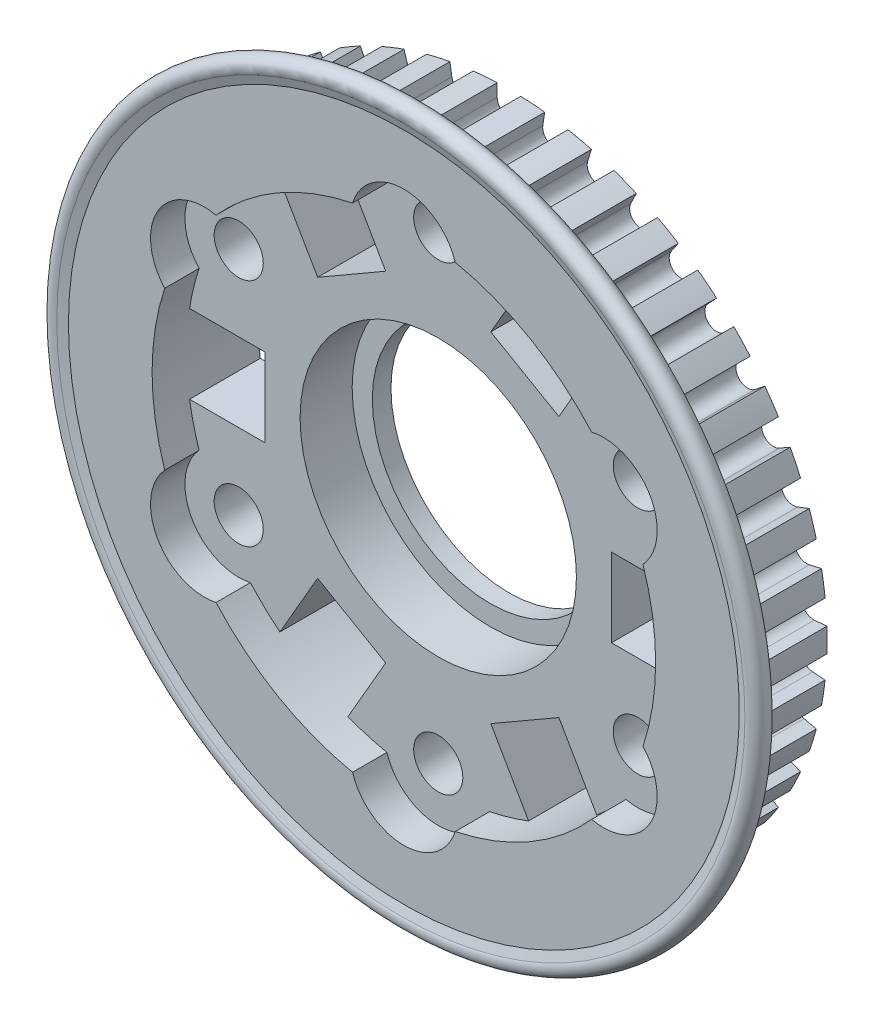
from build123d import *

# Parameters (mm, degrees)
CUT_EXTRUDE1_DEPTH  = 3.556
SKETCH6_R           = 2.54
CUT_EXTRUDE2_DEPTH  = 53.934626978
SKETCH7_R           = 4.1529
CUT_EXTRUDE3_DEPTH  = 1.397
SKETCH8_R           = 4.1275
SKETCH8_R_2         = 2.54
BOSS_EXTRUDE2_DEPTH = 1.27
CUT_EXTRUDE4_DEPTH  = 8.1788


with BuildPart() as part:
    # Sketch3 → Revolve1 (revolve)
    with BuildSketch(Plane(origin=(0, 0, 0), x_dir=(0, 0, -1), z_dir=(1, 0, 0)), mode=Mode.PRIVATE) as revolve1_sk:
        with BuildLine():
            Line((0, 0), (0, 34.685198437))
            Line((0, 34.685198437), (-0.312399402, 35.577423957))
            ThreePointArc((-0.312399402, 35.577423957), (0.184517491, 36.98938238), (1.548961275, 36.373877591))
            Line((1.548961275, 36.373877591), (2.698395469, 32.893))
            Line((2.698395469, 32.893), (10.8712, 32.893))
            Line((10.8712, 32.893), (10.8712, 0))
            Line((10.8712, 0), (0, 0))
        make_face()
    revolve(revolve1_sk.sketch.rotate(Axis((0, 0, -6.21665), (0, 0, 1)), 90), axis=Axis((0, 0, -6.21665), (0, 0, 1)))

    # Sketch4 → Cut-Revolve2 (revolve, cut)
    with BuildSketch(Plane(origin=(0, 0, 0), x_dir=(0, 0, -1), z_dir=(1, 0, 0)), mode=Mode.PRIVATE) as cut_revolve2_sk:
        Polygon((10.8712, 0), (10.8712, 12.2047), (8.9408, 12.2047), (8.9408, 14.2875), (0, 14.2875), (0, 0), align=None)
    revolve(cut_revolve2_sk.sketch.rotate(Axis((0, 0, -6.21665), (0, 0, 1)), 90), axis=Axis((0, 0, -6.21665), (0, 0, 1)), mode=Mode.SUBTRACT)

    # Sketch5 → Cut-Extrude1 (cut)
    with BuildSketch(Plane.XY):
        with BuildLine():
            ThreePointArc((-5.308223189, 25.488114712), (-13.0175, 22.546971388), (-19.419243241, 17.341113486))
            ThreePointArc((-19.419243241, 17.341113486), (-25.450581361, 14.6939), (-24.72746643, 8.147001226))
            ThreePointArc((-24.72746643, 8.147001226), (-26.035, 0), (-24.72746643, -8.147001226))
            ThreePointArc((-24.72746643, -8.147001226), (-25.450581361, -14.6939), (-19.419243241, -17.341113486))
            ThreePointArc((-19.419243241, -17.341113486), (-13.0175, -22.546971388), (-5.308223189, -25.488114712))
            ThreePointArc((-5.308223189, -25.488114712), (0, -29.3878), (5.308223189, -25.488114712))
            ThreePointArc((5.308223189, -25.488114712), (13.0175, -22.546971388), (19.419243241, -17.341113486))
            ThreePointArc((19.419243241, -17.341113486), (25.450581361, -14.6939), (24.72746643, -8.147001226))
            ThreePointArc((24.72746643, -8.147001226), (26.035, 0), (24.72746643, 8.147001226))
            ThreePointArc((24.72746643, 8.147001226), (25.450581361, 14.6939), (19.419243241, 17.341113486))
            ThreePointArc((19.419243241, 17.341113486), (13.0175, 22.546971388), (5.308223189, 25.488114712))
            ThreePointArc((5.308223189, 25.488114712), (0, 29.3878), (-5.308223189, 25.488114712))
        make_face()
    extrude(amount=-CUT_EXTRUDE1_DEPTH, mode=Mode.SUBTRACT)

    # Sketch6 → Cut-Extrude2 (cut, through all)
    with BuildSketch(Plane.XY.offset(-3.556)):
        with Locations((0, 23.8252)):
            Circle(SKETCH6_R)
        with Locations((20.63322845, 11.9126)):
            Circle(SKETCH6_R)
        with Locations((20.63322845, -11.9126)):
            Circle(SKETCH6_R)
        with Locations((0, -23.8252)):
            Circle(SKETCH6_R)
        with Locations((-20.63322845, -11.9126)):
            Circle(SKETCH6_R)
        with Locations((-20.63322845, 11.9126)):
            Circle(SKETCH6_R)
        with BuildLine():
            Line((9.338399585, 24.302582542), (5.433972759, 17.539916906))
            Line((5.433972759, 17.539916906), (12.473027241, 13.475916906))
            Line((12.473027241, 13.475916906), (16.377454066, 20.238582542))
            ThreePointArc((16.377454066, 20.238582542), (13.0175, 22.546971388), (9.338399585, 24.302582542))
        make_face()
        with BuildLine():
            Line((25.715853651, -4.064), (17.907, -4.064))
            Line((17.907, -4.064), (17.907, 4.064))
            Line((17.907, 4.064), (25.715853651, 4.064))
            ThreePointArc((25.715853651, 4.064), (26.035, 0), (25.715853651, -4.064))
        make_face()
        with BuildLine():
            Line((9.338399585, -24.302582542), (5.433972759, -17.539916906))
            Line((5.433972759, -17.539916906), (12.473027241, -13.475916906))
            Line((12.473027241, -13.475916906), (16.377454066, -20.238582542))
            ThreePointArc((16.377454066, -20.238582542), (13.0175, -22.546971388), (9.338399585, -24.302582542))
        make_face()
        with BuildLine():
            Line((-16.377454066, -20.238582542), (-12.473027241, -13.475916906))
            Line((-12.473027241, -13.475916906), (-5.433972759, -17.539916906))
            Line((-5.433972759, -17.539916906), (-9.338399585, -24.302582542))
            ThreePointArc((-9.338399585, -24.302582542), (-13.0175, -22.546971388), (-16.377454066, -20.238582542))
        make_face()
        with BuildLine():
            Line((-25.715853651, 4.064), (-17.907, 4.064))
            Line((-17.907, 4.064), (-17.907, -4.064))
            Line((-17.907, -4.064), (-25.715853651, -4.064))
            ThreePointArc((-25.715853651, -4.064), (-26.035, 0), (-25.715853651, 4.064))
        make_face()
        with BuildLine():
            Line((-9.338399585, 24.302582542), (-5.433972759, 17.539916906))
            Line((-5.433972759, 17.539916906), (-12.473027241, 13.475916906))
            Line((-12.473027241, 13.475916906), (-16.377454066, 20.238582542))
            ThreePointArc((-16.377454066, 20.238582542), (-13.0175, 22.546971388), (-9.338399585, 24.302582542))
        make_face()
    extrude(amount=-CUT_EXTRUDE2_DEPTH, mode=Mode.SUBTRACT)

    # Sketch7 → Cut-Extrude3 (cut)
    with BuildSketch(Plane(origin=(0, 0, -10.8712), x_dir=(-1, 0, 0), z_dir=(0, 0, -1))):
        with Locations((0, 23.8252)):
            Circle(SKETCH7_R)
    extrude(amount=-CUT_EXTRUDE3_DEPTH, mode=Mode.SUBTRACT)

    # Sketch8 → Boss-Extrude2 (add)
    with BuildSketch(Plane(origin=(0, 0, -10.8712), x_dir=(-1, 0, 0), z_dir=(0, 0, -1))):
        with Locations((0, -23.8252)):
            Circle(SKETCH8_R)
        with Locations(Location((0, -23.8252, 0), (0, 0, 180))):
            Circle(SKETCH8_R_2, mode=Mode.SUBTRACT)
    extrude(amount=BOSS_EXTRUDE2_DEPTH)

    # Sketch9 → Cut-Extrude4 (cut)
    with BuildSketch(Plane(origin=(0, 0, -10.8712), x_dir=(-1, 0, 0), z_dir=(0, 0, -1))):
        with BuildLine():
            Line((1.2192, 31.5722), (1.2192, 32.870397022))
            ThreePointArc((1.2192, 32.870397022), (0, 32.893), (-1.2192, 32.870397022))
            Line((-1.2192, 32.870397022), (-1.2192, 31.5722))
            ThreePointArc((-1.2192, 31.5722), (0, 30.353), (1.2192, 31.5722))
        make_face()
        with BuildLine():
            Line((5.91117478, 31.037852281), (6.104661006, 32.321549514))
            ThreePointArc((6.104661006, 32.321549514), (4.902447261, 32.525612367), (3.693495919, 32.684974176))
            Line((3.693495919, 32.684974176), (3.500009693, 31.401276943))
            ThreePointArc((3.500009693, 31.401276943), (4.523879905, 30.013982068), (5.91117478, 31.037852281))
        make_face()
        with BuildLine():
            Line((10.471103682, 29.81017023), (10.853753972, 31.050692001))
            ThreePointArc((10.853753972, 31.050692001), (9.695381952, 31.431656301), (8.523685242, 31.769423018))
            Line((8.523685242, 31.769423018), (8.141034953, 30.528901247))
            ThreePointArc((8.141034953, 30.528901247), (8.946703809, 29.004501374), (10.471103682, 29.81017023))
        make_face()
        with BuildLine():
            Line((14.797125432, 27.916578236), (15.36039201, 29.086213337))
            ThreePointArc((15.36039201, 29.086213337), (14.271737831, 29.635568972), (13.163469522, 30.144195447))
            Line((13.163469522, 30.144195447), (12.600202944, 28.974560346))
            ThreePointArc((12.600202944, 28.974560346), (13.169673133, 27.347108047), (14.797125432, 27.916578236))
        make_face()
        with BuildLine():
            Line((18.792603851, 25.399376016), (19.523904272, 26.471996732))
            ThreePointArc((19.523904272, 26.471996732), (18.52928667, 27.177472004), (17.509203645, 27.845596361))
            Line((17.509203645, 27.845596361), (16.777903224, 26.772975645))
            ThreePointArc((16.777903224, 26.772975645), (17.098453722, 25.078825517), (18.792603851, 25.399376016))
        make_face()
        with BuildLine():
            Line((22.368286554, 22.314793706), (23.251284776, 23.266439463))
            ThreePointArc((23.251284776, 23.266439463), (22.372921863, 24.11227522), (21.463811092, 24.924972666))
            Line((21.463811092, 24.924972666), (20.580812869, 23.97332691))
            ThreePointArc((20.580812869, 23.97332691), (20.64528311, 22.250323466), (22.368286554, 22.314793706))
        make_face()
        with BuildLine():
            Line((25.444298697, 18.731735779), (26.459269999, 19.541148383))
            ThreePointArc((26.459269999, 19.541148383), (25.716782953, 20.508450053), (24.938952466, 21.447566269))
            Line((24.938952466, 21.447566269), (23.923981164, 20.638153666))
            ThreePointArc((23.923981164, 20.638153666), (23.730930987, 18.924785956), (25.444298697, 18.731735779))
        make_face()
        with BuildLine():
            Line((27.951927253, 14.730241828), (29.076198853, 15.379340339))
            ThreePointArc((29.076198853, 15.379340339), (28.486173607, 16.4465), (27.856998853, 17.491056683))
            Line((27.856998853, 17.491056683), (26.732727253, 16.841958172))
            ThreePointArc((26.732727253, 16.841958172), (26.286469081, 15.1765), (27.951927253, 14.730241828))
        make_face()
        with BuildLine():
            Line((29.835155944, 10.399698615), (31.043613472, 10.873983245))
            ThreePointArc((31.043613472, 10.873983245), (30.619230214, 12.017162314), (30.152765918, 13.143825794))
            Line((30.152765918, 13.143825794), (28.94430839, 12.669541164))
            ThreePointArc((28.94430839, 12.669541164), (28.254810893, 11.089196113), (29.835155944, 10.399698615))
        make_face()
        with BuildLine():
            Line((31.051916552, 5.836843321), (32.317565064, 6.125719334))
            ThreePointArc((32.317565064, 6.125719334), (32.068303815, 7.319381081), (31.774970018, 8.502983555))
            Line((31.774970018, 8.502983555), (30.509321506, 8.214107542))
            ThreePointArc((30.509321506, 8.214107542), (29.591986918, 6.754177908), (31.051916552, 5.836843321))
        make_face()
        with BuildLine():
            Line((31.575028655, 1.143602591), (32.869595655, 1.240616976))
            ThreePointArc((32.869595655, 1.240616976), (32.801024501, 2.458096968), (32.687373795, 3.672198715))
            Line((32.687373795, 3.672198715), (31.392806795, 3.57518433))
            ThreePointArc((31.392806795, 3.57518433), (30.268126856, 2.268282531), (31.575028655, 1.143602591))
        make_face()
        with BuildLine():
            Line((31.392806795, -3.57518433), (32.687373795, -3.672198715))
            ThreePointArc((32.687373795, -3.672198715), (32.801024501, -2.458096968), (32.869595655, -1.240616976))
            Line((32.869595655, -1.240616976), (31.575028655, -1.143602591))
            ThreePointArc((31.575028655, -1.143602591), (30.268126856, -2.268282531), (31.392806795, -3.57518433))
        make_face()
        with BuildLine():
            Line((30.509321506, -8.214107542), (31.774970018, -8.502983555))
            ThreePointArc((31.774970018, -8.502983555), (32.068303815, -7.319381081), (32.317565064, -6.125719334))
            Line((32.317565064, -6.125719334), (31.051916552, -5.836843321))
            ThreePointArc((31.051916552, -5.836843321), (29.591986918, -6.754177908), (30.509321506, -8.214107542))
        make_face()
        with BuildLine():
            Line((28.94430839, -12.669541164), (30.152765918, -13.143825794))
            ThreePointArc((30.152765918, -13.143825794), (30.619230214, -12.017162314), (31.043613472, -10.873983245))
            Line((31.043613472, -10.873983245), (29.835155944, -10.399698615))
            ThreePointArc((29.835155944, -10.399698615), (28.254810893, -11.089196113), (28.94430839, -12.669541164))
        make_face()
        with BuildLine():
            Line((26.732727253, -16.841958172), (27.856998853, -17.491056683))
            ThreePointArc((27.856998853, -17.491056683), (28.486173607, -16.4465), (29.076198853, -15.379340339))
            Line((29.076198853, -15.379340339), (27.951927253, -14.730241828))
            ThreePointArc((27.951927253, -14.730241828), (26.286469081, -15.1765), (26.732727253, -16.841958172))
        make_face()
        with BuildLine():
            Line((23.923981164, -20.638153666), (24.938952466, -21.447566269))
            ThreePointArc((24.938952466, -21.447566269), (25.716782953, -20.508450053), (26.459269999, -19.541148383))
            Line((26.459269999, -19.541148383), (25.444298697, -18.731735779))
            ThreePointArc((25.444298697, -18.731735779), (23.730930987, -18.924785956), (23.923981164, -20.638153666))
        make_face()
        with BuildLine():
            Line((20.580812869, -23.97332691), (21.463811092, -24.924972666))
            ThreePointArc((21.463811092, -24.924972666), (22.372921863, -24.11227522), (23.251284776, -23.266439463))
            Line((23.251284776, -23.266439463), (22.368286554, -22.314793706))
            ThreePointArc((22.368286554, -22.314793706), (20.64528311, -22.250323466), (20.580812869, -23.97332691))
        make_face()
        with BuildLine():
            Line((16.777903224, -26.772975645), (17.509203645, -27.845596361))
            ThreePointArc((17.509203645, -27.845596361), (18.52928667, -27.177472004), (19.523904272, -26.471996732))
            Line((19.523904272, -26.471996732), (18.792603851, -25.399376016))
            ThreePointArc((18.792603851, -25.399376016), (17.098453722, -25.078825517), (16.777903224, -26.772975645))
        make_face()
        with BuildLine():
            Line((12.600202944, -28.974560346), (13.163469522, -30.144195447))
            ThreePointArc((13.163469522, -30.144195447), (14.271737831, -29.635568972), (15.36039201, -29.086213337))
            Line((15.36039201, -29.086213337), (14.797125432, -27.916578236))
            ThreePointArc((14.797125432, -27.916578236), (13.169673133, -27.347108047), (12.600202944, -28.974560346))
        make_face()
        with BuildLine():
            Line((8.141034953, -30.528901247), (8.523685242, -31.769423018))
            ThreePointArc((8.523685242, -31.769423018), (9.695381952, -31.431656301), (10.853753972, -31.050692001))
            Line((10.853753972, -31.050692001), (10.471103682, -29.81017023))
            ThreePointArc((10.471103682, -29.81017023), (8.946703809, -29.004501374), (8.141034953, -30.528901247))
        make_face()
        with BuildLine():
            Line((3.500009693, -31.401276943), (3.693495919, -32.684974176))
            ThreePointArc((3.693495919, -32.684974176), (4.902447261, -32.525612367), (6.104661006, -32.321549514))
            Line((6.104661006, -32.321549514), (5.91117478, -31.037852281))
            ThreePointArc((5.91117478, -31.037852281), (4.523879905, -30.013982068), (3.500009693, -31.401276943))
        make_face()
        with BuildLine():
            Line((-1.2192, -31.5722), (-1.2192, -32.870397022))
            ThreePointArc((-1.2192, -32.870397022), (0, -32.893), (1.2192, -32.870397022))
            Line((1.2192, -32.870397022), (1.2192, -31.5722))
            ThreePointArc((1.2192, -31.5722), (0, -30.353), (-1.2192, -31.5722))
        make_face()
        with BuildLine():
            Line((-5.91117478, -31.037852281), (-6.104661006, -32.321549514))
            ThreePointArc((-6.104661006, -32.321549514), (-4.902447261, -32.525612367), (-3.693495919, -32.684974176))
            Line((-3.693495919, -32.684974176), (-3.500009693, -31.401276943))
            ThreePointArc((-3.500009693, -31.401276943), (-4.523879905, -30.013982068), (-5.91117478, -31.037852281))
        make_face()
        with BuildLine():
            Line((-10.471103682, -29.81017023), (-10.853753972, -31.050692001))
            ThreePointArc((-10.853753972, -31.050692001), (-9.695381952, -31.431656301), (-8.523685242, -31.769423018))
            Line((-8.523685242, -31.769423018), (-8.141034953, -30.528901247))
            ThreePointArc((-8.141034953, -30.528901247), (-8.946703809, -29.004501374), (-10.471103682, -29.81017023))
        make_face()
        with BuildLine():
            Line((-14.797125432, -27.916578236), (-15.36039201, -29.086213337))
            ThreePointArc((-15.36039201, -29.086213337), (-14.271737831, -29.635568972), (-13.163469522, -30.144195447))
            Line((-13.163469522, -30.144195447), (-12.600202944, -28.974560346))
            ThreePointArc((-12.600202944, -28.974560346), (-13.169673133, -27.347108047), (-14.797125432, -27.916578236))
        make_face()
        with BuildLine():
            Line((-18.792603851, -25.399376016), (-19.523904272, -26.471996732))
            ThreePointArc((-19.523904272, -26.471996732), (-18.52928667, -27.177472004), (-17.509203645, -27.845596361))
            Line((-17.509203645, -27.845596361), (-16.777903224, -26.772975645))
            ThreePointArc((-16.777903224, -26.772975645), (-17.098453722, -25.078825517), (-18.792603851, -25.399376016))
        make_face()
        with BuildLine():
            Line((-22.368286554, -22.314793706), (-23.251284776, -23.266439463))
            ThreePointArc((-23.251284776, -23.266439463), (-22.372921863, -24.11227522), (-21.463811092, -24.924972666))
            Line((-21.463811092, -24.924972666), (-20.580812869, -23.97332691))
            ThreePointArc((-20.580812869, -23.97332691), (-20.64528311, -22.250323466), (-22.368286554, -22.314793706))
        make_face()
        with BuildLine():
            Line((-25.444298697, -18.731735779), (-26.459269999, -19.541148383))
            ThreePointArc((-26.459269999, -19.541148383), (-25.716782953, -20.508450053), (-24.938952466, -21.447566269))
            Line((-24.938952466, -21.447566269), (-23.923981164, -20.638153666))
            ThreePointArc((-23.923981164, -20.638153666), (-23.730930987, -18.924785956), (-25.444298697, -18.731735779))
        make_face()
        with BuildLine():
            Line((-27.951927253, -14.730241828), (-29.076198853, -15.379340339))
            ThreePointArc((-29.076198853, -15.379340339), (-28.486173607, -16.4465), (-27.856998853, -17.491056683))
            Line((-27.856998853, -17.491056683), (-26.732727253, -16.841958172))
            ThreePointArc((-26.732727253, -16.841958172), (-26.286469081, -15.1765), (-27.951927253, -14.730241828))
        make_face()
        with BuildLine():
            Line((-29.835155944, -10.399698615), (-31.043613472, -10.873983245))
            ThreePointArc((-31.043613472, -10.873983245), (-30.619230214, -12.017162314), (-30.152765918, -13.143825794))
            Line((-30.152765918, -13.143825794), (-28.94430839, -12.669541164))
            ThreePointArc((-28.94430839, -12.669541164), (-28.254810893, -11.089196113), (-29.835155944, -10.399698615))
        make_face()
        with BuildLine():
            Line((-31.051916552, -5.836843321), (-32.317565064, -6.125719334))
            ThreePointArc((-32.317565064, -6.125719334), (-32.068303815, -7.319381081), (-31.774970018, -8.502983555))
            Line((-31.774970018, -8.502983555), (-30.509321506, -8.214107542))
            ThreePointArc((-30.509321506, -8.214107542), (-29.591986918, -6.754177908), (-31.051916552, -5.836843321))
        make_face()
        with BuildLine():
            Line((-31.575028655, -1.143602591), (-32.869595655, -1.240616976))
            ThreePointArc((-32.869595655, -1.240616976), (-32.801024501, -2.458096968), (-32.687373795, -3.672198715))
            Line((-32.687373795, -3.672198715), (-31.392806795, -3.57518433))
            ThreePointArc((-31.392806795, -3.57518433), (-30.268126856, -2.268282531), (-31.575028655, -1.143602591))
        make_face()
        with BuildLine():
            Line((-31.392806795, 3.57518433), (-32.687373795, 3.672198715))
            ThreePointArc((-32.687373795, 3.672198715), (-32.801024501, 2.458096968), (-32.869595655, 1.240616976))
            Line((-32.869595655, 1.240616976), (-31.575028655, 1.143602591))
            ThreePointArc((-31.575028655, 1.143602591), (-30.268126856, 2.268282531), (-31.392806795, 3.57518433))
        make_face()
        with BuildLine():
            Line((-30.509321506, 8.214107542), (-31.774970018, 8.502983555))
            ThreePointArc((-31.774970018, 8.502983555), (-32.068303815, 7.319381081), (-32.317565064, 6.125719334))
            Line((-32.317565064, 6.125719334), (-31.051916552, 5.836843321))
            ThreePointArc((-31.051916552, 5.836843321), (-29.591986918, 6.754177908), (-30.509321506, 8.214107542))
        make_face()
        with BuildLine():
            Line((-28.94430839, 12.669541164), (-30.152765918, 13.143825794))
            ThreePointArc((-30.152765918, 13.143825794), (-30.619230214, 12.017162314), (-31.043613472, 10.873983245))
            Line((-31.043613472, 10.873983245), (-29.835155944, 10.399698615))
            ThreePointArc((-29.835155944, 10.399698615), (-28.254810893, 11.089196113), (-28.94430839, 12.669541164))
        make_face()
        with BuildLine():
            Line((-26.732727253, 16.841958172), (-27.856998853, 17.491056683))
            ThreePointArc((-27.856998853, 17.491056683), (-28.486173607, 16.4465), (-29.076198853, 15.379340339))
            Line((-29.076198853, 15.379340339), (-27.951927253, 14.730241828))
            ThreePointArc((-27.951927253, 14.730241828), (-26.286469081, 15.1765), (-26.732727253, 16.841958172))
        make_face()
        with BuildLine():
            Line((-23.923981164, 20.638153666), (-24.938952466, 21.447566269))
            ThreePointArc((-24.938952466, 21.447566269), (-25.716782953, 20.508450053), (-26.459269999, 19.541148383))
            Line((-26.459269999, 19.541148383), (-25.444298697, 18.731735779))
            ThreePointArc((-25.444298697, 18.731735779), (-23.730930987, 18.924785956), (-23.923981164, 20.638153666))
        make_face()
        with BuildLine():
            Line((-20.580812869, 23.97332691), (-21.463811092, 24.924972666))
            ThreePointArc((-21.463811092, 24.924972666), (-22.372921863, 24.11227522), (-23.251284776, 23.266439463))
            Line((-23.251284776, 23.266439463), (-22.368286554, 22.314793706))
            ThreePointArc((-22.368286554, 22.314793706), (-20.64528311, 22.250323466), (-20.580812869, 23.97332691))
        make_face()
        with BuildLine():
            Line((-16.777903224, 26.772975645), (-17.509203645, 27.845596361))
            ThreePointArc((-17.509203645, 27.845596361), (-18.52928667, 27.177472004), (-19.523904272, 26.471996732))
            Line((-19.523904272, 26.471996732), (-18.792603851, 25.399376016))
            ThreePointArc((-18.792603851, 25.399376016), (-17.098453722, 25.078825517), (-16.777903224, 26.772975645))
        make_face()
        with BuildLine():
            Line((-12.600202944, 28.974560346), (-13.163469522, 30.144195447))
            ThreePointArc((-13.163469522, 30.144195447), (-14.271737831, 29.635568972), (-15.36039201, 29.086213337))
            Line((-15.36039201, 29.086213337), (-14.797125432, 27.916578236))
            ThreePointArc((-14.797125432, 27.916578236), (-13.169673133, 27.347108047), (-12.600202944, 28.974560346))
        make_face()
        with BuildLine():
            Line((-8.141034953, 30.528901247), (-8.523685242, 31.769423018))
            ThreePointArc((-8.523685242, 31.769423018), (-9.695381952, 31.431656301), (-10.853753972, 31.050692001))
            Line((-10.853753972, 31.050692001), (-10.471103682, 29.81017023))
            ThreePointArc((-10.471103682, 29.81017023), (-8.946703809, 29.004501374), (-8.141034953, 30.528901247))
        make_face()
        with BuildLine():
            Line((-3.500009693, 31.401276943), (-3.693495919, 32.684974176))
            ThreePointArc((-3.693495919, 32.684974176), (-4.902447261, 32.525612367), (-6.104661006, 32.321549514))
            Line((-6.104661006, 32.321549514), (-5.91117478, 31.037852281))
            ThreePointArc((-5.91117478, 31.037852281), (-4.523879905, 30.013982068), (-3.500009693, 31.401276943))
        make_face()
    extrude(amount=-CUT_EXTRUDE4_DEPTH, mode=Mode.SUBTRACT)


solid = part.part
